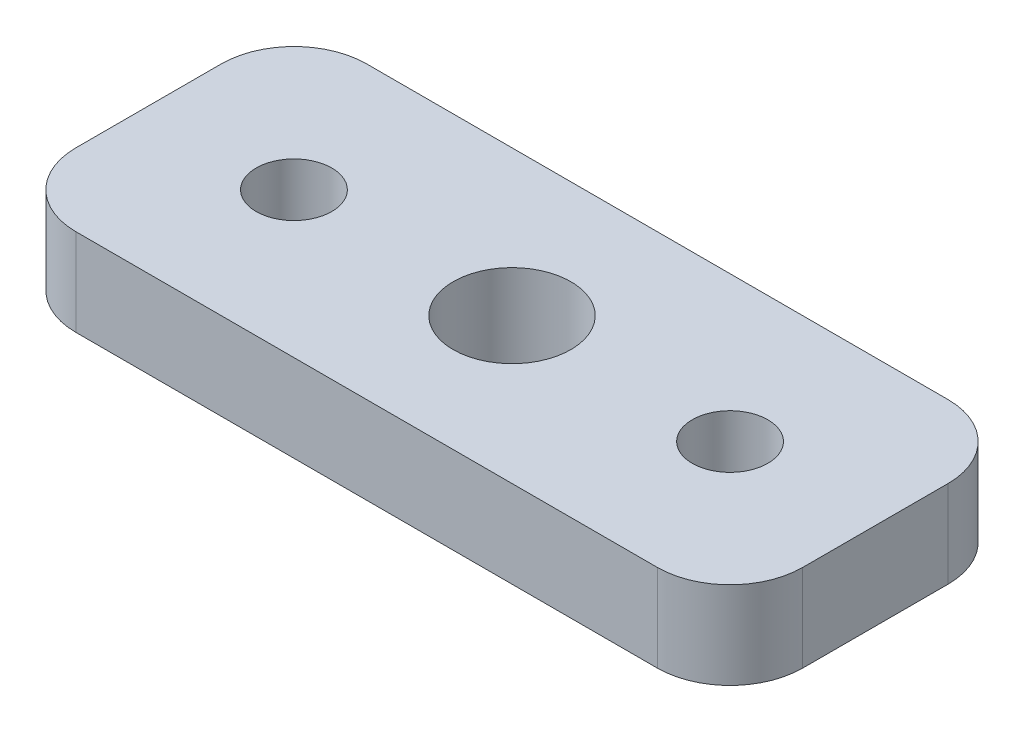
from build123d import *

# Parameters (mm, degrees)
ESBO_O1_W                = 50
ESBO_O1_H                = 20
RESSALTO_EXTRUS_O1_DEPTH = 3
ESBO_O3_R                = 4.05
ESBO_O3_R_2              = 2.6
CORTE_EXTRUS_O1_DEPTH    = 6
FILETE1_R                = 5


with BuildPart() as part:
    # Esboço1 → Ressalto-extrusão1 (new, symmetric)
    with BuildSketch(Plane(origin=(0, 0, 0), x_dir=(1, 0, 0), z_dir=(0, 1, 0))):
        Rectangle(ESBO_O1_W, ESBO_O1_H)
    extrude(amount=RESSALTO_EXTRUS_O1_DEPTH, both=True)

    # Esboço3 → Corte-extrusão1 (cut)
    with BuildSketch(Plane(origin=(0, 3, 0), x_dir=(1, 0, 0), z_dir=(0, 1, 0))):
        with Locations(Location((0, 0, 0), (0, 0, 270))):
            Circle(ESBO_O3_R)
        with Locations(Location((-15, 0, 0), (0, 0, 270))):
            Circle(ESBO_O3_R_2)
        with Locations(Location((15, 0, 0), (0, 0, 90))):
            Circle(ESBO_O3_R_2)
    extrude(amount=-CORTE_EXTRUS_O1_DEPTH, mode=Mode.SUBTRACT)

    # Filete1
    filete1_edges = [part.edges().sort_by_distance(p)[0] for p in [
        (25, 0, 10),
        (-25, 0, 10),
        (-25, 0, -10),
        (25, 0, -10),
    ]]
    fillet(filete1_edges, radius=FILETE1_R)


solid = part.part
